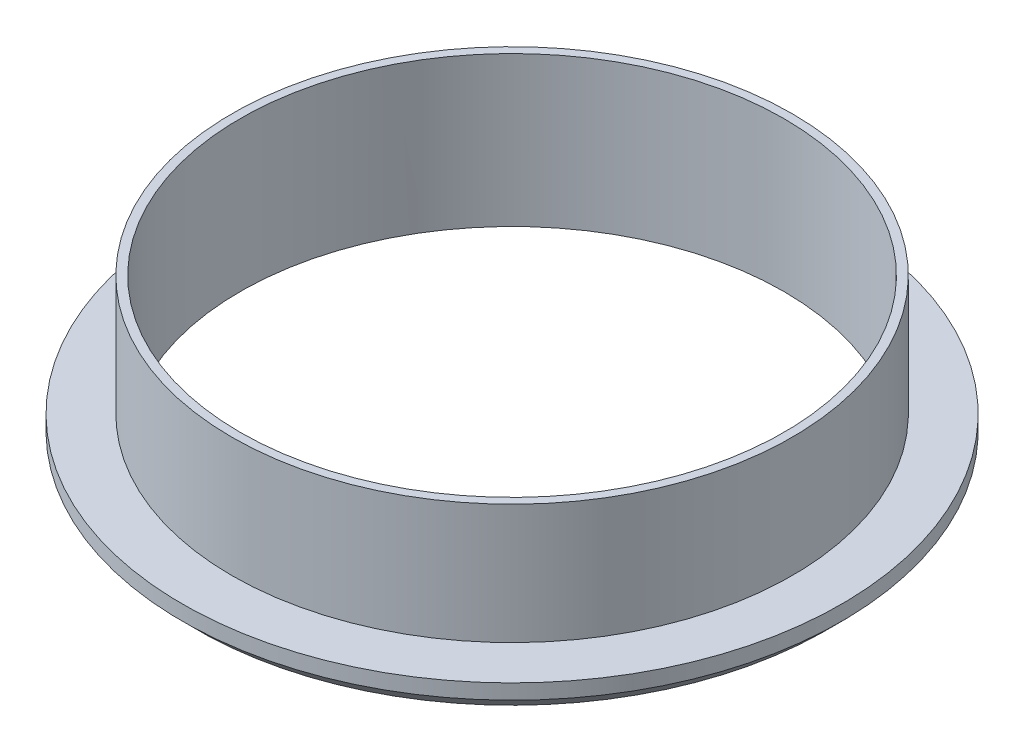
from build123d import *
from build123d.topology import SkipClean

# Parameters (mm, degrees)
SKETCH1_R           = 14.8463
SKETCH1_R_2         = 14.4018
BOSS_EXTRUDE1_DEPTH = 6.35
BOSS_EXTRUDE2_START = 1.5875
SKETCH2_R           = 17.4625
SKETCH2_R_2         = 14.4018
BOSS_EXTRUDE2_DEPTH = 1.5875
CHAMFER2_SIZE       = 0.79375


with BuildPart() as part:
    # Sketch1 → Boss-Extrude1 (new body)
    with BuildSketch(Plane(origin=(0, 0, 0), x_dir=(1, 0, 0), z_dir=(0, 1, 0))):
        with Locations(Location((0, 0, 0), (0, 0, 270))):
            Circle(SKETCH1_R)
        with Locations(Location((0, 0, 0), (0, 0, 270))):
            Circle(SKETCH1_R_2, mode=Mode.SUBTRACT)
    extrude(amount=BOSS_EXTRUDE1_DEPTH)

    # Sketch2 → Boss-Extrude2 (add)
    with SkipClean():  # the faces are left unmerged after this step: merging them gives an invalid solid
        with BuildSketch(Plane.XZ.offset(BOSS_EXTRUDE2_START)):
            with Locations(Location((0, 0, 0), (0, 0, 270))):
                Circle(SKETCH2_R)
            with Locations(Location((0, 0, 0), (0, 0, 270))):
                Circle(SKETCH2_R_2, mode=Mode.SUBTRACT)
        extrude(amount=-BOSS_EXTRUDE2_DEPTH)

    # Chamfer2
    chamfer2_edges = [part.edges().sort_by_distance(p)[0] for p in [
        (0, -1.5875, 17.4625),
    ]]
    chamfer(chamfer2_edges, length=CHAMFER2_SIZE)


solid = part.part
